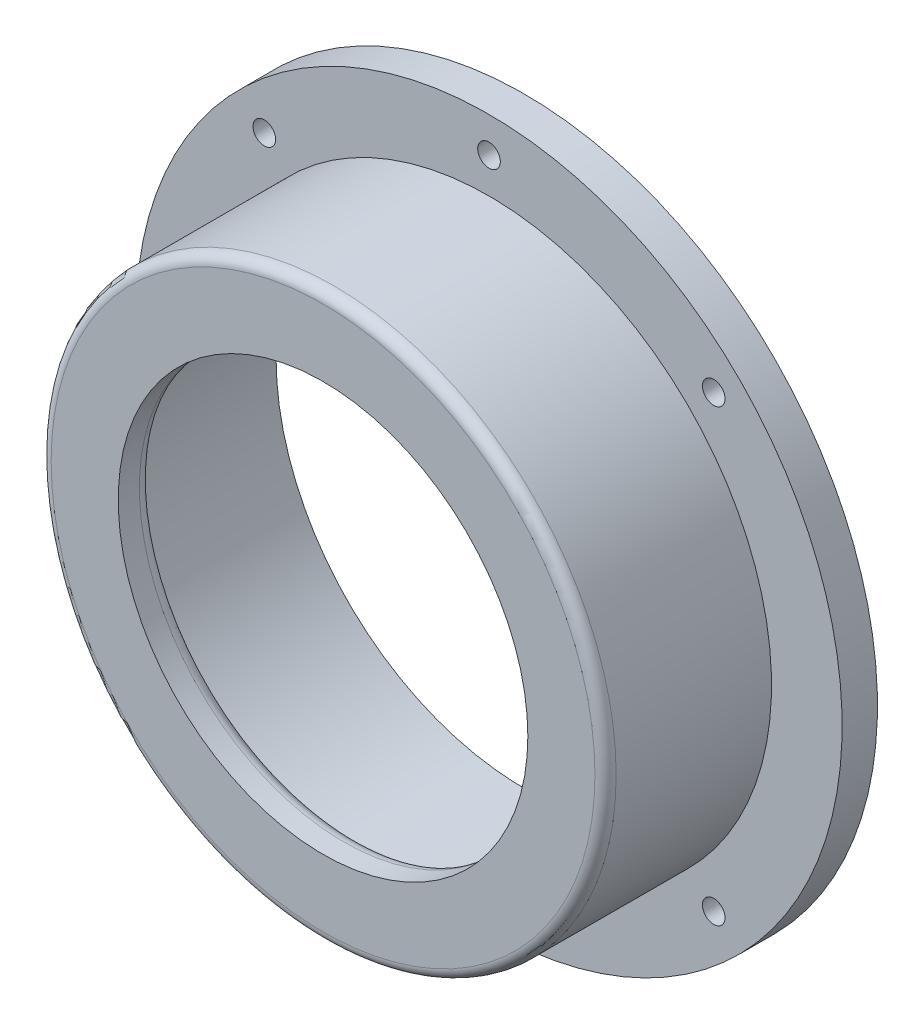
from build123d import *

# Parameters (mm, degrees)
SKETCH_1_R          = 40
SKETCH_1_R_2        = 35.15
EXTRUDE_1_DEPTH     = 28.5
SKETCH_2_R          = 35.5
SKETCH_2_R_2        = 29
EXTRUDE_2_DEPTH     = 5
SKETCH_3_R          = 50
SKETCH_3_R_2        = 40
EXTRUDE_3_DEPTH     = 5
SKETCH_4_R          = 1.6
CUT_EXTRUDE_1_DEPTH = 75.51342161
FILLET_1_R          = 1.5
FILLET_2_R          = 2


with BuildPart() as part:
    # 草图1 → 凸台-拉伸1 (new body)
    with BuildSketch(Plane.XY):
        with Locations(Location((0, 0, 0), (0, 0, 180))):
            Circle(SKETCH_1_R)
        with Locations(Location((0, 0, 0), (0, 0, 180))):
            Circle(SKETCH_1_R_2, mode=Mode.SUBTRACT)
    extrude(amount=EXTRUDE_1_DEPTH)

    # 草图2 → 凸台-拉伸2 (add)
    with BuildSketch(Plane.XY.offset(28.5)):
        Circle(SKETCH_2_R)
        Circle(SKETCH_2_R_2, mode=Mode.SUBTRACT)
    extrude(amount=-EXTRUDE_2_DEPTH)

    # 草图3 → 凸台-拉伸3 (add)
    with BuildSketch(Plane(origin=(0, 0, 0), x_dir=(-1, 0, 0), z_dir=(0, 0, -1))):
        Circle(SKETCH_3_R)
        Circle(SKETCH_3_R_2, mode=Mode.SUBTRACT)
    extrude(amount=-EXTRUDE_3_DEPTH)

    # 草图4 → 切除-拉伸1 (cut, through all)
    with BuildSketch(Plane.XY.offset(5)):
        with Locations((31.819805153, 31.819805153)):
            Circle(SKETCH_4_R)
        with Locations((31.819805153, -31.819805153)):
            Circle(SKETCH_4_R)
        with Locations((-31.819805153, -31.819805153)):
            Circle(SKETCH_4_R)
        with Locations((-31.819805153, 31.819805153)):
            Circle(SKETCH_4_R)
        with Locations((0, 45)):
            Circle(SKETCH_4_R)
        with Locations((0, -45)):
            Circle(SKETCH_4_R)
    extrude(amount=-CUT_EXTRUDE_1_DEPTH, mode=Mode.SUBTRACT)

    # 圆角1
    fillet_1_edges = [part.edges().sort_by_distance(p)[0] for p in [
        (35.15, 0, 23.5),
        (40, 0, 28.5),
    ]]
    fillet(fillet_1_edges, radius=FILLET_1_R)

    # 圆角2
    fillet_2_edges = [part.edges().sort_by_distance(p)[0] for p in [
        (-29, 0, 23.5),
    ]]
    fillet(fillet_2_edges, radius=FILLET_2_R)


solid = part.part
